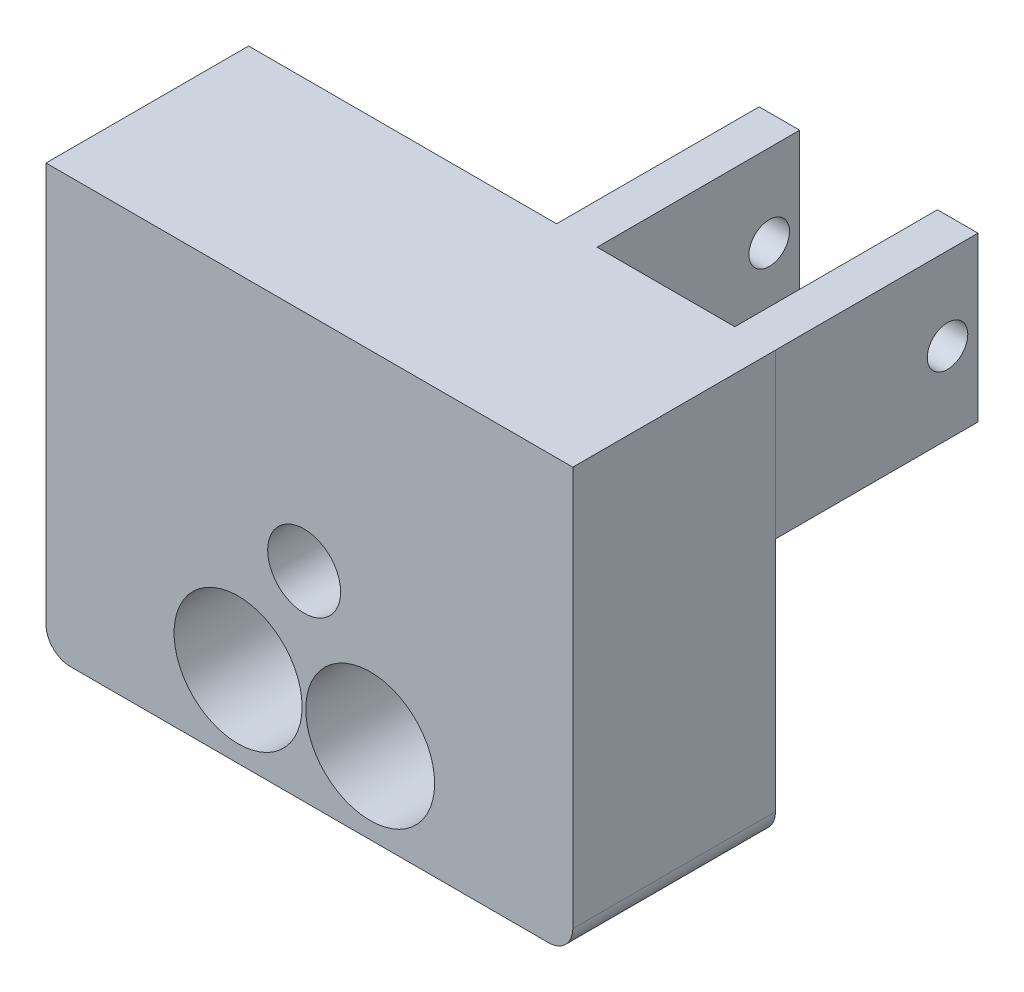
from build123d import *

# Parameters (mm, degrees)
ESQUISSE1_W              = 105
ESQUISSE1_H              = 80
BOSS_EXTRU_1_DEPTH       = 25
ESQUISSE2_R              = 7.9
ESQUISSE2_R_2            = 7.95
ESQUISSE2_R_3            = 4.5
ENL_V_MAT_EXTRU_1_DEPTH  = 135.350288425
ESQUISSE3_R              = 4
ENL_V_MAT_EXTRU_3_DEPTH  = 10
ESQUISSE6_W              = 40
ESQUISSE6_H              = 80
ENL_V_MAT_EXTRU_6_DEPTH  = 135.350288425
ESQUISSE7_W              = 65
ESQUISSE7_H              = 2.68813313
ENL_V_MAT_EXTRU_7_DEPTH  = 135.350288425
CONG_1_R                 = 3
ESQUISSE9_W              = 5
ESQUISSE9_H              = 20.179429856
ESQUISSE9_H_2            = 20.18
BOSS_EXTRU_2_DEPTH       = 25
ESQUISSE10_R             = 2.5
ENL_V_MAT_EXTRU_8_DEPTH  = 105.048287139
ENL_V_MAT_EXTRU_9_DEPTH  = 7.5
ENL_V_MAT_EXTRU_11_DEPTH = 133.767182537
ESQUISSE13_R             = 1.5
ENL_V_MAT_EXTRU_12_DEPTH = 3


with BuildPart() as part:
    # Esquisse1 → Boss.-Extru.1 (new body)
    with BuildSketch(Plane.XY):
        with Locations((52.5, 40)):
            Rectangle(ESQUISSE1_W, ESQUISSE1_H)
    extrude(amount=BOSS_EXTRU_1_DEPTH)

    # Esquisse2 → Enlèv. mat.-Extru.1 (cut, through all)
    with BuildSketch(Plane.XY):
        with Locations((63.7, 10)):
            Circle(ESQUISSE2_R)
        with Locations((80, 10)):
            Circle(ESQUISSE2_R_2)
        with Locations((71.85, 24.633523157)):
            Circle(ESQUISSE2_R_3)
    extrude(amount=ENL_V_MAT_EXTRU_1_DEPTH, mode=Mode.SUBTRACT)

    # Esquisse3 → Enlèv. mat.-Extru.3 (cut)
    with BuildSketch(Plane(origin=(0, 0, 0), x_dir=(1, 0, 0), z_dir=(0, 1, 0))):
        with Locations(Location((49, -12.5, 0), (0, 0, 270))):
            Circle(ESQUISSE3_R)
        with Locations(Location((93, -12.5, 0), (0, 0, 270))):
            Circle(ESQUISSE3_R)
    extrude(amount=ENL_V_MAT_EXTRU_3_DEPTH, mode=Mode.SUBTRACT)

    # Esquisse6 → Enlèv. mat.-Extru.6 (cut, through all)
    with BuildSketch(Plane.XY):
        with Locations((20, 40)):
            Rectangle(ESQUISSE6_W, ESQUISSE6_H)
    extrude(amount=ENL_V_MAT_EXTRU_6_DEPTH, mode=Mode.SUBTRACT)

    # Esquisse7 → Enlèv. mat.-Extru.7 (cut, through all)
    with BuildSketch(Plane.XY):
        with Locations((72.5, 78.655933435)):
            Rectangle(ESQUISSE7_W, ESQUISSE7_H)
    extrude(amount=ENL_V_MAT_EXTRU_7_DEPTH, mode=Mode.SUBTRACT)

    # Congé1
    cong_1_edges = [part.edges().sort_by_distance(p)[0] for p in [
        (40, 0, 12.5),
        (105, 77.31186687, 12.5),
        (40, 77.31186687, 12.5),
        (105, 0, 12.5),
    ]]
    fillet(cong_1_edges, radius=CONG_1_R)

    # Esquisse9 → Boss.-Extru.2 (add)
    with BuildSketch(Plane.XY):
        with Locations((102.49170176, 42.222151942)):
            Rectangle(ESQUISSE9_W, ESQUISSE9_H)
        with Locations((80.49170176, 42.22186687)):
            Rectangle(ESQUISSE9_W, ESQUISSE9_H_2)
    extrude(amount=-BOSS_EXTRU_2_DEPTH)

    # Esquisse10 → Enlèv. mat.-Extru.8 (cut, through all)
    with BuildSketch(Plane(origin=(104.99170176, 0, 0), x_dir=(0, 0, -1), z_dir=(1, 0, 0))):
        with Locations((21.24, 42.132437014)):
            Circle(ESQUISSE10_R)
    extrude(amount=-ENL_V_MAT_EXTRU_8_DEPTH, mode=Mode.SUBTRACT)

    # Esquisse11 → Enlèv. mat.-Extru.9 (cut)
    with BuildSketch(Plane(origin=(0, 0, 0), x_dir=(-1, 0, 0), z_dir=(0, 0, -1))):
        Polygon((-73.38169787, 32.15796566), (-79.132207291, 27.069255143), (-77.600509422, 19.54481264), (-70.31830213, 17.109080655), (-64.567792709, 22.197791172), (-66.099490578, 29.722233675), align=None)
    extrude(amount=-ENL_V_MAT_EXTRU_9_DEPTH, mode=Mode.SUBTRACT)

    # Esquisse12 → Enlèv. mat.-Extru.11 (cut, through all)
    with BuildSketch(Plane(origin=(0, 0, 0), x_dir=(-1, 0, 0), z_dir=(0, 0, -1))):
        Polygon((-105.676011247, 77.330619324), (-105.676011247, 52.31186687), (-104.99170176, 52.31186687), (-39.98533212, 52.31186687), (-39.98533212, 77.330619324), (-104.99170176, 77.330619324), align=None)
    extrude(amount=-ENL_V_MAT_EXTRU_11_DEPTH, mode=Mode.SUBTRACT)

    # Esquisse13 → Enlèv. mat.-Extru.12 (cut)
    with BuildSketch(Plane.ZY.offset(-40)):
        with Locations((15, 14.75187619)):
            Circle(ESQUISSE13_R)
        with Locations((15, 26)):
            Circle(ESQUISSE13_R)
    extrude(amount=-ENL_V_MAT_EXTRU_12_DEPTH, mode=Mode.SUBTRACT)


solid = part.part
